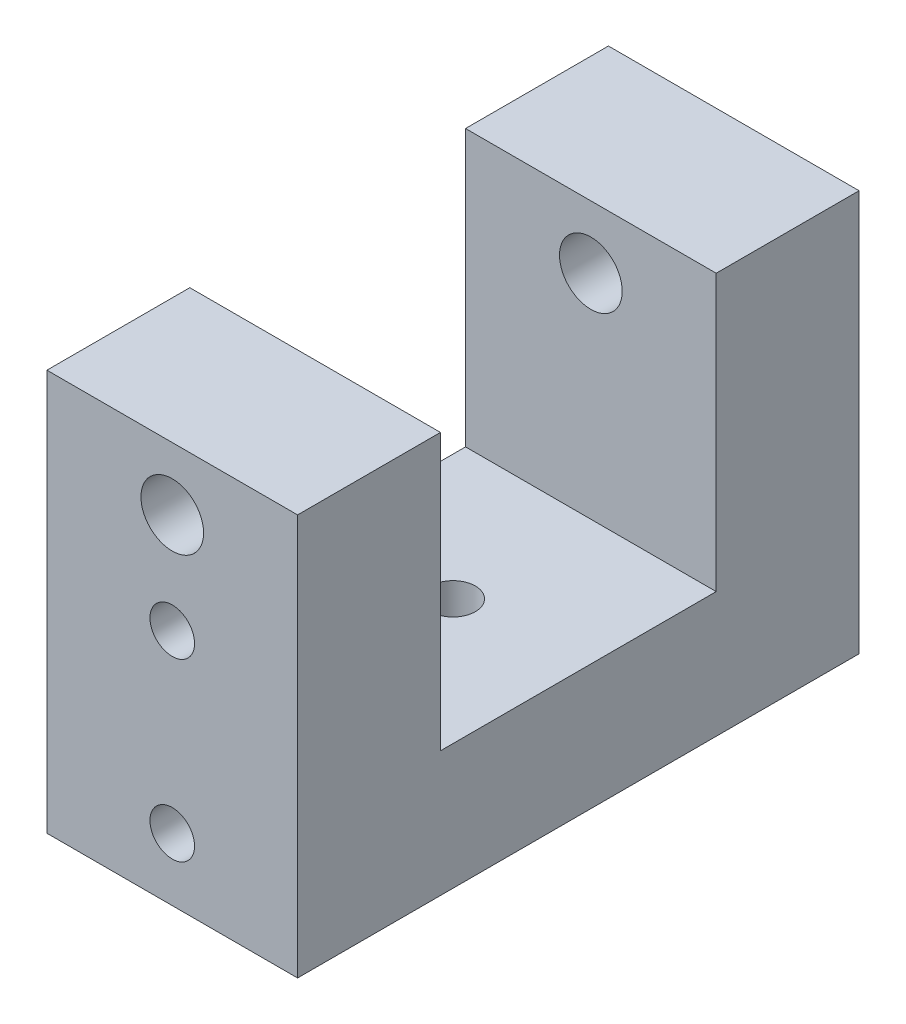
from build123d import *

# Parameters (mm, degrees)
SKETCH1_W                 = 12.7
SKETCH1_H                 = 28.448
BOSS_EXTRUDE1_DEPTH       = 20.32
SKETCH2_W                 = 13.97
SKETCH2_H                 = 13.97
CUT_EXTRUDE1_DEPTH        = 28.866011125
SKETCH5_R                 = 1.5875
CUT_EXTRUDE2_DEPTH        = 36.531867443
F_4_40_TAPPED_HOLE1_D     = 2.2606
F_4_40_TAPPED_HOLE2_D     = 2.2606
F_4_40_TAPPED_HOLE2_DEPTH = 6.35
F_4_40_TAPPED_HOLE2_TIP   = 0.679152758
F_4_40_TAPPED_HOLE3_D     = 2.2606
F_4_40_TAPPED_HOLE3_DEPTH = 6.35
F_4_40_TAPPED_HOLE3_TIP   = 0.679152758


with BuildPart() as part:
    # Sketch1 → Boss-Extrude1 (new body)
    with BuildSketch(Plane(origin=(0, 0, 0), x_dir=(1, 0, 0), z_dir=(0, 1, 0))):
        Rectangle(SKETCH1_W, SKETCH1_H)
    extrude(amount=BOSS_EXTRUDE1_DEPTH)

    # Sketch2 → Cut-Extrude1 (cut, through all)
    with BuildSketch(Plane(origin=(6.35, 0, 0), x_dir=(0, 0, -1), z_dir=(1, 0, 0))):
        with Locations((0, 13.335)):
            Rectangle(SKETCH2_W, SKETCH2_H)
    extrude(amount=-CUT_EXTRUDE1_DEPTH, mode=Mode.SUBTRACT)

    # Sketch5 → Cut-Extrude2 (cut, through all)
    with BuildSketch(Plane.XY.offset(14.224)):
        with Locations((0, 17.145)):
            Circle(SKETCH5_R)
    extrude(amount=-CUT_EXTRUDE2_DEPTH, mode=Mode.SUBTRACT)

    # #4-40 Tapped Hole1 (through all)
    with Locations(Plane(origin=(0, 0, 0), x_dir=(-1, 0, 0), z_dir=(0, -1, 0))):
        with Locations((0, 0)):
            Hole(F_4_40_TAPPED_HOLE1_D / 2)

    # #4-40 Tapped Hole2
    with Locations(Plane(origin=(0, 0, -14.224), x_dir=(-1, 0, 0), z_dir=(0, 0, -1))):
        with Locations((0, 12.065), (0, 3.175)):
            Hole(F_4_40_TAPPED_HOLE2_D / 2, depth=F_4_40_TAPPED_HOLE2_DEPTH)
            with Locations((0, 0, -(F_4_40_TAPPED_HOLE2_DEPTH + F_4_40_TAPPED_HOLE2_TIP / 2))):  # 118° drill point
                Cone(0, F_4_40_TAPPED_HOLE2_D / 2, F_4_40_TAPPED_HOLE2_TIP, mode=Mode.SUBTRACT)

    # #4-40 Tapped Hole3
    with Locations(Plane.XY.offset(14.224)):
        with Locations((0, 12.065), (0, 3.175)):
            Hole(F_4_40_TAPPED_HOLE3_D / 2, depth=F_4_40_TAPPED_HOLE3_DEPTH)
            with Locations((0, 0, -(F_4_40_TAPPED_HOLE3_DEPTH + F_4_40_TAPPED_HOLE3_TIP / 2))):  # 118° drill point
                Cone(0, F_4_40_TAPPED_HOLE3_D / 2, F_4_40_TAPPED_HOLE3_TIP, mode=Mode.SUBTRACT)


solid = part.part
